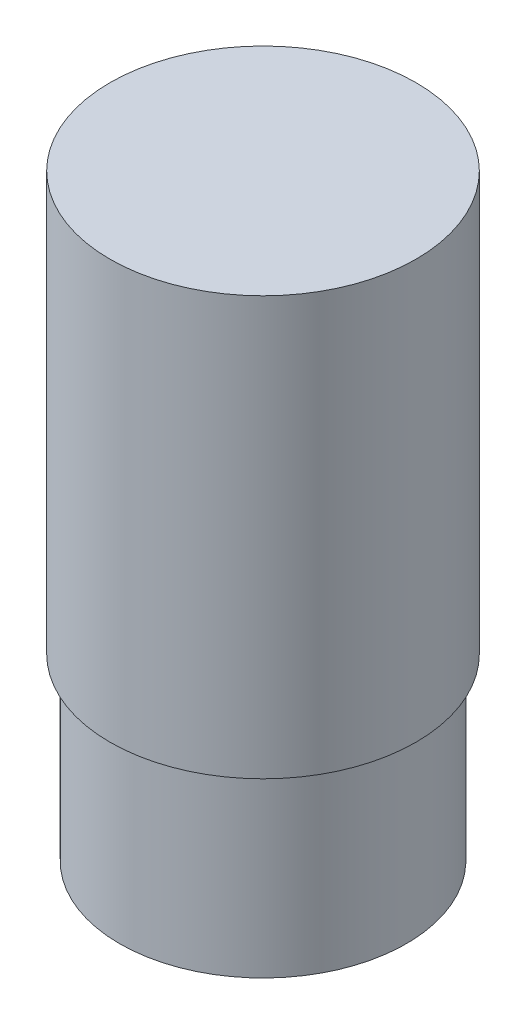
from build123d import *

# Parameters (mm, degrees)
SKETCH1_R           = 4.064
BOSS_EXTRUDE1_DEPTH = 15.875
SKETCH2_R           = 4.064
SKETCH2_R_2         = 3.81
CUT_EXTRUDE1_DEPTH  = 4.7625


with BuildPart() as part:
    # Sketch1 → Boss-Extrude1 (new body)
    with BuildSketch(Plane(origin=(0, 0, 0), x_dir=(1, 0, 0), z_dir=(0, 1, 0))):
        with Locations(Location((0, 0, 0), (0, 0, 270))):
            Circle(SKETCH1_R)
    extrude(amount=BOSS_EXTRUDE1_DEPTH)

    # Sketch2 → Cut-Extrude1 (cut)
    with BuildSketch(Plane.XZ):
        with Locations(Location((0, 0, 0), (0, 0, 270))):
            Circle(SKETCH2_R)
        with Locations(Location((0, 0, 0), (0, 0, 270))):
            Circle(SKETCH2_R_2, mode=Mode.SUBTRACT)
    extrude(amount=-CUT_EXTRUDE1_DEPTH, mode=Mode.SUBTRACT)


solid = part.part
